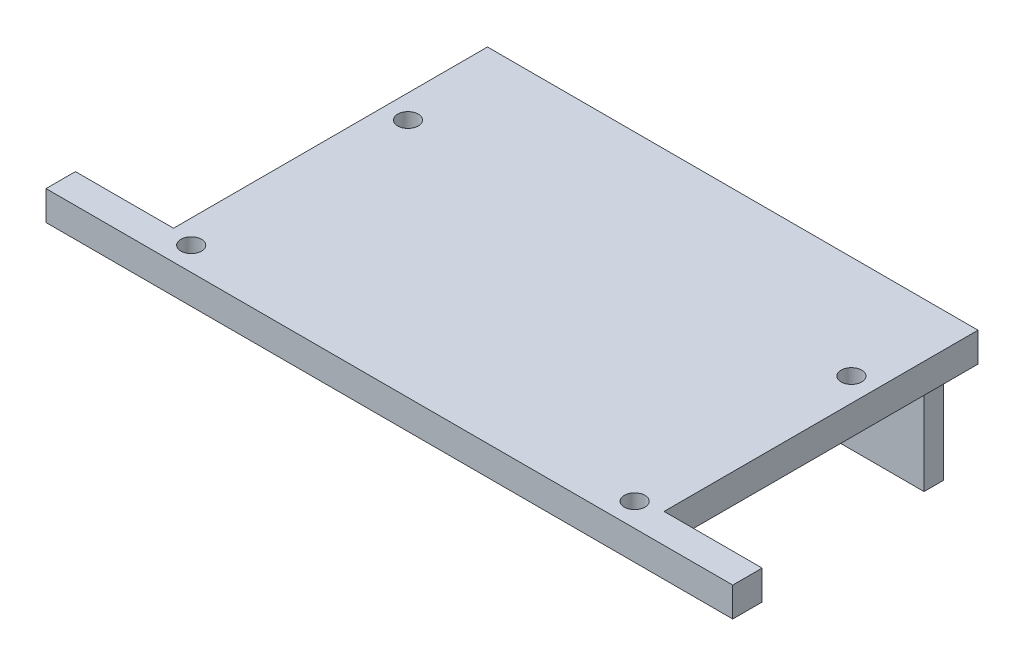
from build123d import *

# Parameters (mm, degrees)
BOSS_EXTRUDE1_DEPTH = 3
SKETCH2_R           = 1.05
CUT_EXTRUDE1_DEPTH  = 3
SKETCH3_R           = 1.05
CUT_EXTRUDE2_DEPTH  = 3
SKETCH4_W           = 15
SKETCH4_H           = 2
SKETCH4_W_2         = 4
BOSS_EXTRUDE2_DEPTH = 12


with BuildPart() as part:
    # Sketch1 → Boss-Extrude1 (new body)
    with BuildSketch(Plane(origin=(0, 0, 0), x_dir=(1, 0, 0), z_dir=(0, 1, 0))):
        Polygon((-26.238881315, 17.558528428), (23.761118685, 17.558528428), (23.761118685, -14.441471572), (33.761118685, -14.441471572), (33.761118685, -17.441471572), (23.761118685, -17.441471572), (-26.238881315, -17.441471572), (-36.238881315, -17.441471572), (-36.238881315, -14.441471572), (-26.238881315, -14.441471572), align=None)
    extrude(amount=BOSS_EXTRUDE1_DEPTH)

    # Sketch2 → Cut-Extrude1 (cut)
    with BuildSketch(Plane(origin=(0, 3, 0), x_dir=(1, 0, 0), z_dir=(0, 1, 0))):
        with Locations(Location((-23.838881315, -15.041471572, 0), (0, 0, 270))):
            Circle(SKETCH2_R)
        with Locations(Location((21.361118685, -15.041471572, 0), (0, 0, 270))):
            Circle(SKETCH2_R)
    extrude(amount=-CUT_EXTRUDE1_DEPTH, mode=Mode.SUBTRACT)

    # Sketch3 → Cut-Extrude2 (cut)
    with BuildSketch(Plane(origin=(0, 3, 0), x_dir=(1, 0, 0), z_dir=(0, 1, 0))):
        with Locations(Location((-23.838881315, 7.058528428, 0), (0, 0, 270))):
            Circle(SKETCH3_R)
        with Locations(Location((21.361118685, 7.058528428, 0), (0, 0, 270))):
            Circle(SKETCH3_R)
    extrude(amount=-CUT_EXTRUDE2_DEPTH, mode=Mode.SUBTRACT)

    # Sketch4 → Boss-Extrude2 (add)
    with BuildSketch(Plane.XZ):
        with Locations((12.761118685, -16.558528428)):
            Rectangle(SKETCH4_W, SKETCH4_H)
        with Locations((-20.738881315, -16.558528428)):
            Rectangle(SKETCH4_W_2, SKETCH4_H)
    extrude(amount=BOSS_EXTRUDE2_DEPTH)


solid = part.part
